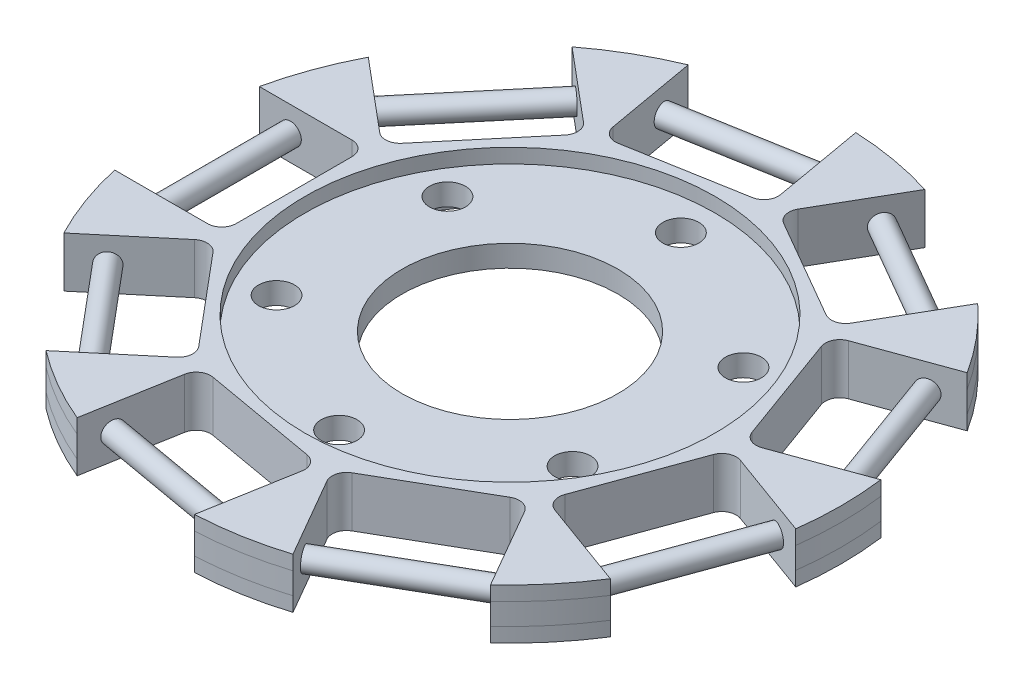
from build123d import *

# Parameters (mm, degrees)
SKETCH_2_R               = 2.5
CUT_EXTRUDE_1_DEPTH      = 10
CUT_EXTRUDE_START        = -10
CUT_EXTRUDE_3_DEPTH      = 10
SKETCH_5_R               = 1.5
EXTRUDE_1_DEPTH          = 20.1
PATTERN_CIRCULAR_8_COUNT = 9


with BuildPart() as part:
    # ｽｹｯﾁ1 → 回転1 (revolve)
    with BuildSketch(Plane.XY, mode=Mode.PRIVATE) as revolve_1_sk:
        Polygon((-15, -3.484577548), (-15, -0.484577548), (-28.5, -0.484577548), (-28.5, 1.515422452), (-46, 1.515422452), (-46, -0.484577548), (-45.9999, -3.484577548), (-46, -5.484577548), (-28.5, -5.484577548), (-28.5, -3.484577548), align=None)
    revolve(revolve_1_sk.sketch.rotate(Axis((0, 0, 0), (0, 1, 0)), 270), axis=Axis((0, 0, 0), (0, 1, 0)))

    # ｽｹｯﾁ2 → ｶｯﾄ - 押し出し1 (cut)
    with BuildSketch(Plane(origin=(0, -0.484577548, 0), x_dir=(1, 0, 0), z_dir=(0, 1, 0))):
        with Locations(Location((0, 23.75, 0), (0, 0, 270))):
            Circle(SKETCH_2_R)
        with Locations(Location((20.56810334, 11.875, 0), (0, 0, 270))):
            Circle(SKETCH_2_R)
        with Locations(Location((20.56810334, -11.875, 0), (0, 0, 270))):
            Circle(SKETCH_2_R)
        with Locations(Location((0, -23.75, 0), (0, 0, 270))):
            Circle(SKETCH_2_R)
        with Locations(Location((-20.56810334, -11.875, 0), (0, 0, 270))):
            Circle(SKETCH_2_R)
        with Locations(Location((-20.56810334, 11.875, 0), (0, 0, 270))):
            Circle(SKETCH_2_R)
    extrude(amount=-CUT_EXTRUDE_1_DEPTH, mode=Mode.SUBTRACT)

    # ｽｹｯﾁ3 → ｶｯﾄ - 押し出し3 (cut)
    with BuildSketch(Plane(origin=(0, 1.515422452, 0), x_dir=(1, 0, 0), z_dir=(0, 1, 0)).offset(CUT_EXTRUDE_START)):
        with BuildLine():
            Line((4.340576232, 33.259012282), (2.102472879, 45.951927139))
            ThreePointArc((2.102472879, 45.951927139), (-7.987816173, 45.301156639), (-17.692162956, 42.461598768))
            Line((-17.692162956, 42.461598768), (-15.454059603, 29.768683911))
            ThreePointArc((-15.454059603, 29.768683911), (-14.63159697, 28.477676178), (-13.137147742, 28.14636476))
            Line((-13.137147742, 28.14636476), (2.718257082, 30.942100421))
            ThreePointArc((2.718257082, 30.942100421), (4.009264815, 31.764563054), (4.340576232, 33.259012282))
        make_face()
        with BuildLine():
            Line((8.0284955, 30.005762114), (21.9715045, 21.955762114))
            ThreePointArc((21.9715045, 21.955762114), (23.489142591, 21.755961269), (24.703555308, 22.687812921))
            Line((24.703555308, 22.687812921), (31.147917072, 33.849774919))
            ThreePointArc((31.147917072, 33.849774919), (23, 39.837168574), (13.740806456, 43.899774919))
            Line((13.740806456, 43.899774919), (7.296444692, 32.737812921))
            ThreePointArc((7.296444692, 32.737812921), (7.096643847, 31.220174831), (8.0284955, 30.005762114))
        make_face()
        with BuildLine():
            ThreePointArc((45.618904696, 5.908936816), (43.225860556, 15.732926593), (38.744299816, 24.796758494))
            Line((38.744299816, 24.796758494), (26.632861425, 20.388555425))
            ThreePointArc((26.632861425, 20.388555425), (25.504286137, 19.354406707), (25.43751647, 17.825129897))
            Line((25.43751647, 17.825129897), (30.944040777, 2.696078702))
            ThreePointArc((30.944040777, 2.696078702), (31.978189495, 1.567503415), (33.507466306, 1.500733748))
            Line((33.507466306, 1.500733748), (45.618904696, 5.908936816))
        make_face()
        with BuildLine():
            ThreePointArc((38.744299816, -24.796758494), (43.225860556, -15.732926593), (45.618904696, -5.908936816))
            Line((45.618904696, -5.908936816), (33.507466306, -1.500733748))
            ThreePointArc((33.507466306, -1.500733748), (31.978189495, -1.567503415), (30.944040777, -2.696078702))
            Line((30.944040777, -2.696078702), (25.43751647, -17.825129897))
            ThreePointArc((25.43751647, -17.825129897), (25.504286137, -19.354406707), (26.632861425, -20.388555425))
            Line((26.632861425, -20.388555425), (38.744299816, -24.796758494))
        make_face()
        with BuildLine():
            ThreePointArc((13.740806456, -43.899774919), (23, -39.837168574), (31.147917072, -33.849774919))
            Line((31.147917072, -33.849774919), (24.703555308, -22.687812921))
            ThreePointArc((24.703555308, -22.687812921), (23.489142591, -21.755961269), (21.9715045, -21.955762114))
            Line((21.9715045, -21.955762114), (8.0284955, -30.005762114))
            ThreePointArc((8.0284955, -30.005762114), (7.096643847, -31.220174831), (7.296444692, -32.737812921))
            Line((7.296444692, -32.737812921), (13.740806456, -43.899774919))
        make_face()
        with BuildLine():
            ThreePointArc((-17.692162956, -42.461598768), (-7.987816173, -45.301156639), (2.102472879, -45.951927139))
            Line((2.102472879, -45.951927139), (4.340576232, -33.259012282))
            ThreePointArc((4.340576232, -33.259012282), (4.009264815, -31.764563054), (2.718257082, -30.942100421))
            Line((2.718257082, -30.942100421), (-13.137147742, -28.14636476))
            ThreePointArc((-13.137147742, -28.14636476), (-14.63159697, -28.477676178), (-15.454059603, -29.768683911))
            Line((-15.454059603, -29.768683911), (-17.692162956, -42.461598768))
        make_face()
        with BuildLine():
            Line((-30.973437657, -12.870456857), (-40.846772695, -21.155168645))
            ThreePointArc((-40.846772695, -21.155168645), (-35.238044383, -29.568230046), (-27.92674174, -36.552661952))
            Line((-27.92674174, -36.552661952), (-18.053406702, -28.267950163))
            ThreePointArc((-18.053406702, -28.267950163), (-17.346592526, -26.910172763), (-17.806893036, -25.450286058))
            Line((-17.806893036, -25.450286058), (-28.155773552, -13.116970523))
            ThreePointArc((-28.155773552, -13.116970523), (-29.513550952, -12.410156347), (-30.973437657, -12.870456857))
        make_face()
        with BuildLine():
            Line((-32, 10.05), (-44.888723528, 10.05))
            ThreePointArc((-44.888723528, 10.05), (-46, 0), (-44.888723528, -10.05))
            Line((-44.888723528, -10.05), (-32, -10.05))
            ThreePointArc((-32, -10.05), (-30.585786438, -9.464213562), (-30, -8.05))
            Line((-30, -8.05), (-30, 8.05))
            ThreePointArc((-30, 8.05), (-30.585786438, 9.464213562), (-32, 10.05))
        make_face()
        with BuildLine():
            Line((-18.053406702, 28.267950163), (-27.92674174, 36.552661952))
            ThreePointArc((-27.92674174, 36.552661952), (-35.238044383, 29.568230046), (-40.846772695, 21.155168645))
            Line((-40.846772695, 21.155168645), (-30.973437657, 12.870456857))
            ThreePointArc((-30.973437657, 12.870456857), (-29.513550952, 12.410156347), (-28.155773552, 13.116970523))
            Line((-28.155773552, 13.116970523), (-17.806893036, 25.450286058))
            ThreePointArc((-17.806893036, 25.450286058), (-17.346592526, 26.910172763), (-18.053406702, 28.267950163))
        make_face()
    extrude(amount=CUT_EXTRUDE_3_DEPTH, mode=Mode.SUBTRACT)

    # ｽｹｯﾁ5 → ﾎﾞｽ - 押し出し1 (add)
    with BuildSketch(Plane(origin=(-9.897317918, 0, 1.745164186), x_dir=(-0.1736481776669516, 0, -0.9848077530122044), z_dir=(0.9848077530122044, 0, -0.1736481776669516))):
        with Locations((40.55, -1.984577548)):
            Circle(SKETCH_5_R)
    extrude_1 = extrude(amount=EXTRUDE_1_DEPTH)

    # 円形ﾊﾟﾀｰﾝ8: ﾎﾞｽ - 押し出し1 ×9 about axis
    pattern_circular_8_axis = Axis((0, 0, 0), (0, -1, 0))
    for i in range(1, PATTERN_CIRCULAR_8_COUNT):
        add(extrude_1.rotate(pattern_circular_8_axis, i * 360 / PATTERN_CIRCULAR_8_COUNT))


solid = part.part
